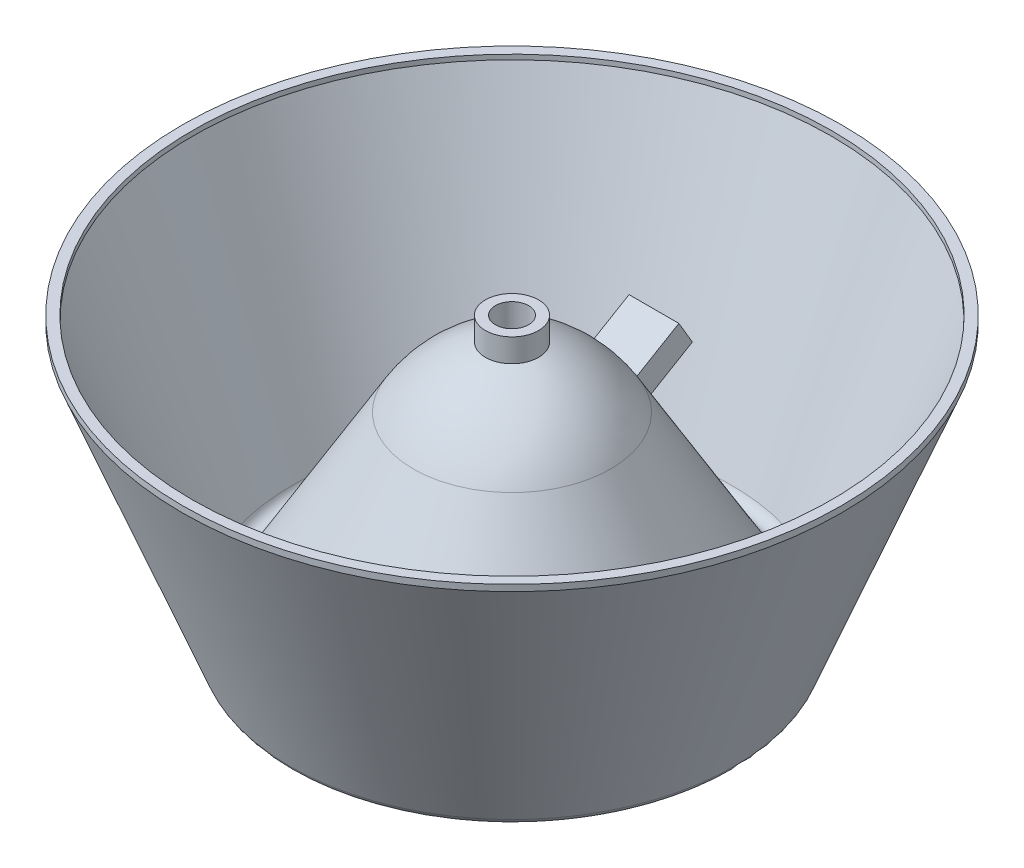
from build123d import *

# Parameters (mm, degrees)
SKETCH2_W           = 15
SKETCH2_H           = 50
CUT_EXTRUDE1_DEPTH  = 1
SKETCH5_W           = 15
SKETCH5_H           = 8
BOSS_EXTRUDE1_DEPTH = 15


with BuildPart() as part:
    # Sketch1 → Revolve7 (revolve)
    with BuildSketch(Plane(origin=(0, 0, 0), x_dir=(0, 0, -1), z_dir=(1, 0, 0))):
        with BuildLine():
            Line((-61.371087, -39.717122139), (-27.130920736, 18.231080979))
            ThreePointArc((-27.130920736, 18.231080979), (-17.689796022, 29.084281592), (-5, 35.858931127))
            Line((-5, 35.858931127), (-5, 45))
            Line((-5, 45), (-8, 45))
            Line((-8, 45), (-8, 37.992245332))
            ThreePointArc((-8, 37.992245332), (-20.415266058, 30.730416935), (-29.713738459, 19.757204371))
            Line((-29.713738459, 19.757204371), (-60.832382285, -32.908120885))
            ThreePointArc((-60.832382285, -32.908120885), (-63.651810303, -34.372652199), (-66.205866039, -32.482989368))
            Line((-66.205866039, -32.482989368), (-96.206333671, 43.558703481))
            Line((-96.206333671, 43.558703481), (-96.251196427, 45))
            Line((-96.251196427, 45), (-99.251196427, 45))
            Line((-99.251196427, 45), (-99.251196427, 43.102019876))
            Line((-99.251196427, 43.102019876), (-66.744570754, -39.291990621))
            ThreePointArc((-66.744570754, -39.291990621), (-64.190515018, -41.181653452), (-61.371087, -39.717122139))
        make_face()
    revolve(axis=Axis((0, 0, 0), (0, -1, 0)))

    # Sketch2 → Cut-Extrude1 (cut)
    with BuildSketch(Plane(origin=(0, 18.126463109, -30.677303315), x_dir=(-1, 0, 0), z_dir=(0, 0.5087077972413765, -0.8609392411929117))):
        with Locations((0, -25)):
            Rectangle(SKETCH2_W, SKETCH2_H)
    extrude(amount=-CUT_EXTRUDE1_DEPTH, mode=Mode.SUBTRACT)

    # Sketch5 → Boss-Extrude1 (add)
    with BuildSketch(Plane(origin=(0, 17.617755312, -29.816364073), x_dir=(-1, 0, 0), z_dir=(0, 0.5087077972413765, -0.8609392411929117))):
        with Locations((0, -4)):
            Rectangle(SKETCH5_W, SKETCH5_H)
    extrude(amount=BOSS_EXTRUDE1_DEPTH)


solid = part.part
